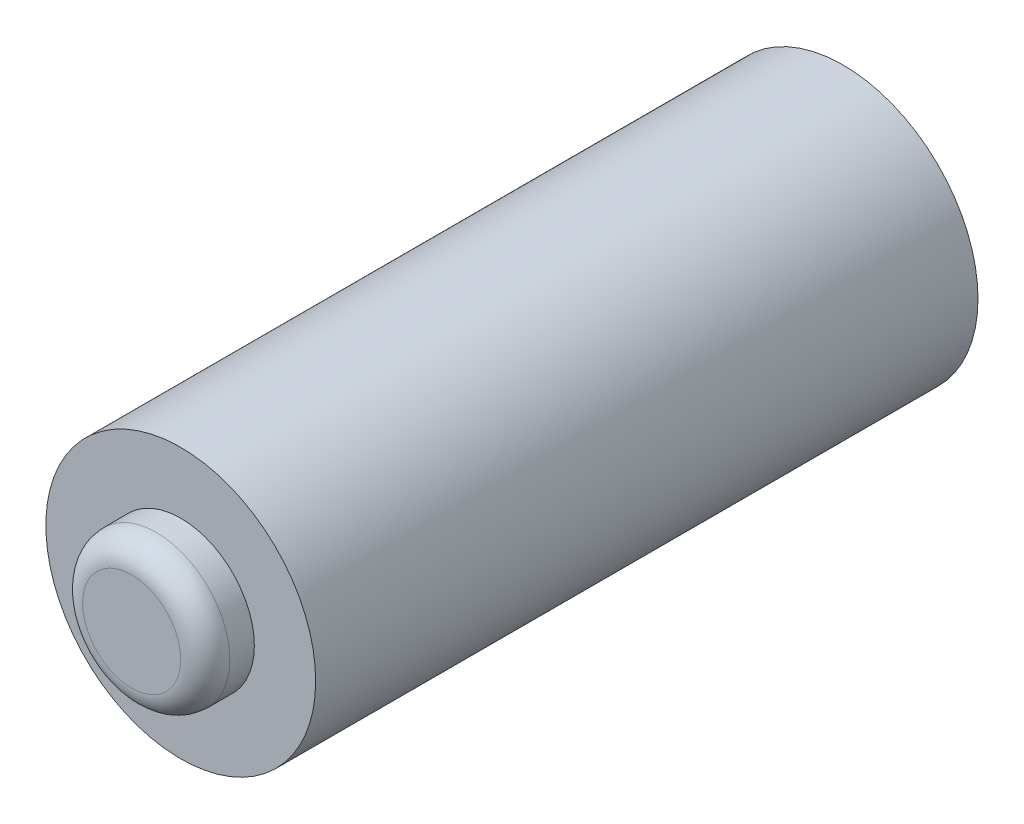
from build123d import *

# Parameters (mm, degrees)
SKETCH1_R           = 2.75
BOSS_EXTRUDE1_DEPTH = 13.5
SKETCH3_R           = 1.5
BOSS_EXTRUDE2_DEPTH = 1
FILLET1_R           = 0.5
BOSS_EXTRUDE3_START = 1
SKETCH4_R           = 1.5
BOSS_EXTRUDE3_DEPTH = 1
FILLET2_R           = 0.5


with BuildPart() as part:
    # Sketch1 → Boss-Extrude1 (new body)
    with BuildSketch(Plane.XY):
        Circle(SKETCH1_R)
    extrude(amount=BOSS_EXTRUDE1_DEPTH)

    # Sketch3 → Boss-Extrude2 (add)
    with BuildSketch(Plane.XY.offset(13.5)):
        Circle(SKETCH3_R)
    extrude(amount=BOSS_EXTRUDE2_DEPTH)

    # Fillet1
    fillet1_edges = [part.edges().sort_by_distance(p)[0] for p in [
        (-1.5, 0, 14.5),
    ]]
    fillet(fillet1_edges, radius=FILLET1_R)

    # Sketch4 → Boss-Extrude3 (add)
    with BuildSketch(Plane(origin=(0, 0, 0), x_dir=(-1, 0, 0), z_dir=(0, 0, -1)).offset(BOSS_EXTRUDE3_START)):
        with Locations(Location((0, 0, 0), (0, 0, 180))):
            Circle(SKETCH4_R)
    extrude(amount=-BOSS_EXTRUDE3_DEPTH)

    # Fillet2
    fillet2_edges = [part.edges().sort_by_distance(p)[0] for p in [
        (-1.5, 0, -1),
    ]]
    fillet(fillet2_edges, radius=FILLET2_R)


solid = part.part
